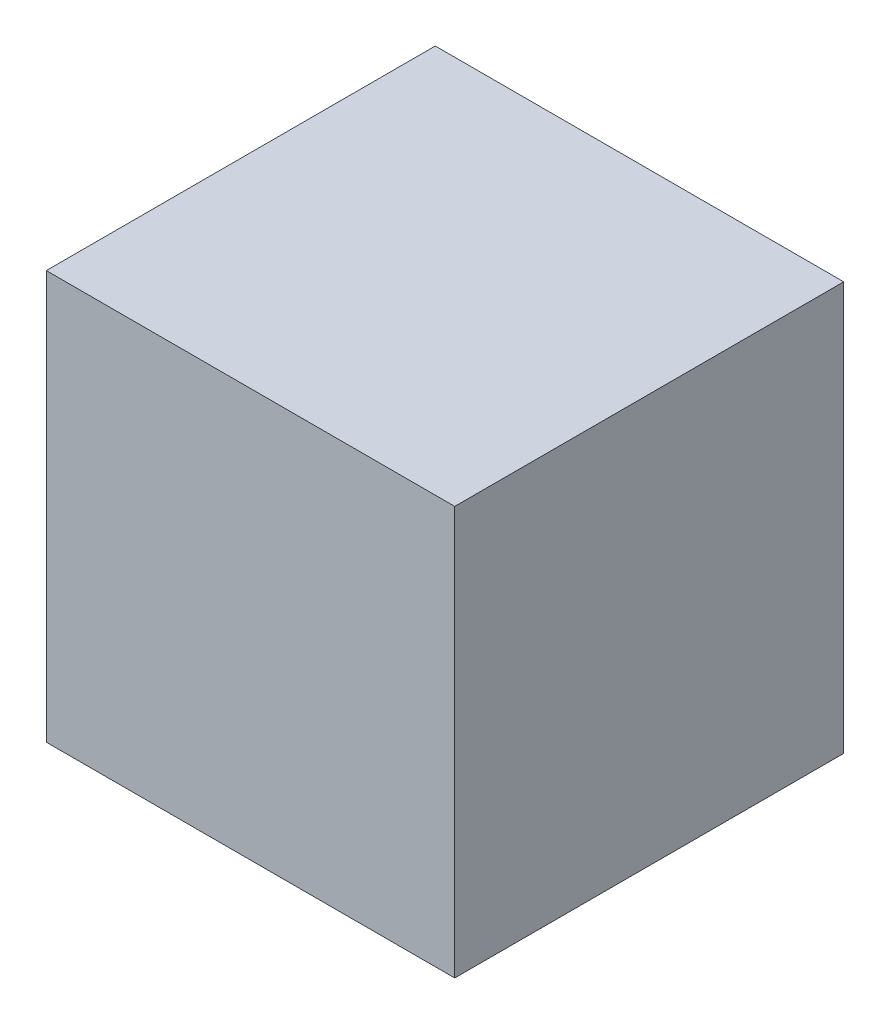
from build123d import *

# Parameters (mm, degrees)
CROQUIS1_W              = 42
CROQUIS1_H              = 42
SALIENTE_EXTRUIR1_DEPTH = 40


with BuildPart() as part:
    # Croquis1 → Saliente-Extruir1 (new body)
    with BuildSketch(Plane.XY):
        Rectangle(CROQUIS1_W, CROQUIS1_H)
    extrude(amount=SALIENTE_EXTRUIR1_DEPTH)


solid = part.part
